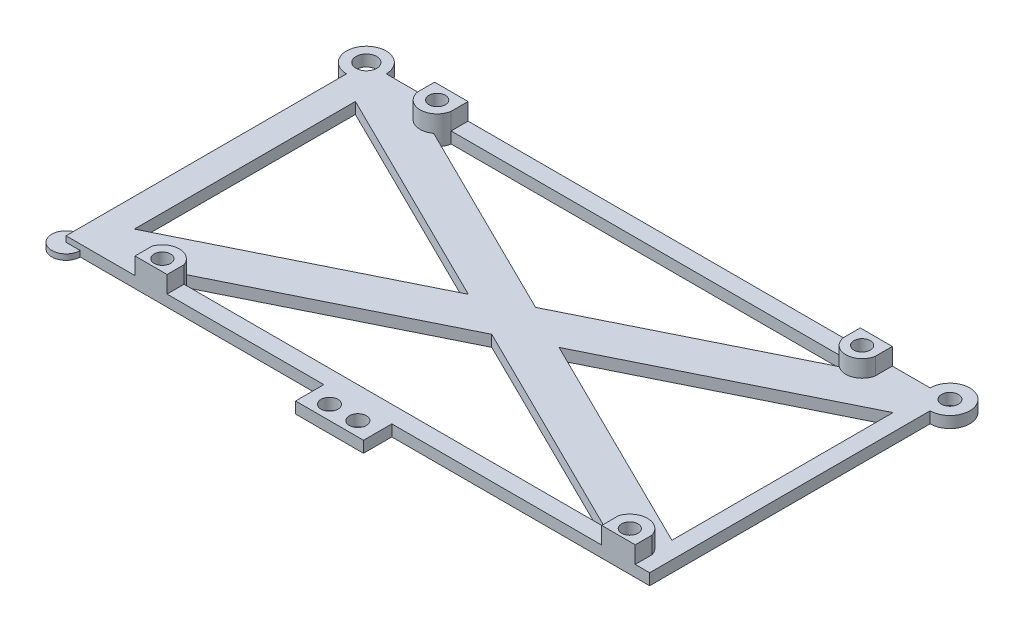
from build123d import *

# Parameters (mm, degrees)
SKETCH1_R             = 1.5
SKETCH1_R_2           = 1.823358757
BOSS_EXTRUDE1_DEPTH   = 2
SKETCH1_W             = 69.213532985
SKETCH1_H             = 3
BOSS_EXTRUDE1_2_DEPTH = 2
SKETCH2_R             = 1.45
SKETCH2_R_2           = 1.449999997
BOSS_EXTRUDE2_DEPTH   = 5
SKETCH3_R             = 2.5
BOSS_EXTRUDE3_DEPTH   = 1


with BuildPart() as part:
    # Sketch1 → Boss-Extrude1 (new body)
    with BuildSketch(Plane(origin=(0, 0, 0), x_dir=(1, 0, 0), z_dir=(0, 1, 0))):
        with BuildLine():
            Line((40.328427125, 26.5), (40.328427125, 23.5))
            ThreePointArc((40.328427125, 23.5), (38.533566599, 21.320123126), (35.739793711, 21.730270106))
            Line((35.739793711, 21.730270106), (-0.120981949, 3.988623195))
            Line((-0.120981949, 3.988623195), (-35.707345562, 21.594508352))
            ThreePointArc((-35.707345562, 21.594508352), (-38.6168059, 21.215624921), (-40.458039892, 23.5))
            Line((-40.458039892, 23.5), (-40.458039892, 26.5))
            Line((-40.458039892, 26.5), (-49, 26.5))
            ThreePointArc((-49, 26.5), (-54.974873735, 28.974873735), (-52.5, 23))
            Line((-52.5, 23), (-52.5, 0))
            Line((-52.5, 0), (-52.5, -26.5))
            Line((-52.5, -26.5), (-40.328427125, -26.5))
            Line((-40.328427125, -26.5), (-40.328427125, -23.5))
            ThreePointArc((-40.328427125, -23.5), (-38.560823049, -21.693818527), (-36.040421728, -21.879001857))
            Line((-36.040421728, -21.879001857), (0.120981949, -3.988623195))
            Line((0.120981949, -3.988623195), (39.558871233, -23.5))
            Line((39.558871233, -23.5), (-34.671572875, -23.5))
            Line((-34.671572875, -23.5), (-34.671572875, -26.5))
            Line((-34.671572875, -26.5), (-7, -26.5))
            Line((-7, -26.5), (-7, -31.5))
            Line((-7, -31.5), (5, -31.5))
            Line((5, -31.5), (5, -26.5))
            Line((5, -26.5), (42.041960109, -26.5))
            Line((42.041960109, -26.5), (42.041960109, -24.5))
            Line((42.041960109, -24.5), (42.041960108, -24.395234694))
            Line((42.041960109, -24.395234694), (42.041960109, -23.5))
            ThreePointArc((42.041960109, -23.5), (45, -21.377501001), (47.958039892, -23.5))
            Line((47.958039892, -23.5), (47.958039892, -26.5))
            Line((47.958039892, -26.5), (50.5, -26.5))
            Line((50.5, -26.5), (50.5, -25.302775638))
            Line((50.5, -25.302775638), (50.5, 22.341687605))
            Line((50.5, 22.341687605), (50.5, 23))
            ThreePointArc((50.5, 23), (52.974873734, 28.974873734), (47, 26.5))
            Line((47, 26.5), (40.328427125, 26.5))
        make_face()
        Polygon((8.062110713, -0.059854228), (47.5, 19.451522577), (47.5, -19.571231035), (42.041960107, -16.870937614), align=None, mode=Mode.SUBTRACT)
        with Locations(Location((-3.5, -29, 0), (0, 0, 270))):
            Circle(SKETCH1_R, mode=Mode.SUBTRACT)
        with Locations(Location((1.5, -29, 0), (0, 0, 270))):
            Circle(SKETCH1_R, mode=Mode.SUBTRACT)
        Polygon((-8.062110713, 0.059854228), (-47.5, -19.451522577), (-47.5, 19.571231035), align=None, mode=Mode.SUBTRACT)
        with Locations(Location((-52.5, 26.5, 0), (0, 0, 270))):
            Circle(SKETCH1_R_2, mode=Mode.SUBTRACT)
        with Locations(Location((50.5, 26.5, 0), (0, 0, 270))):
            Circle(SKETCH1_R, mode=Mode.SUBTRACT)
    extrude(amount=BOSS_EXTRUDE1_DEPTH)



with BuildPart() as body_2:
    # Sketch1 → Boss-Extrude1 2 (new body)
    with BuildSketch(Plane(origin=(0, 0, 0), x_dir=(1, 0, 0), z_dir=(0, 1, 0))):
        with Locations((0.064806384, 25)):
            Rectangle(SKETCH1_W, SKETCH1_H)
    extrude(amount=BOSS_EXTRUDE1_2_DEPTH)


with BuildPart() as part_1:
    add(part.part)

    add(body_2.part)  # Boss-Extrude2 merges body 2
    # Sketch2 → Boss-Extrude2 (add)
    # profile 1 of 4: a face of its own
    with BuildSketch(Plane(origin=(0, 0, 0), x_dir=(1, 0, 0), z_dir=(0, 1, 0))):
        with BuildLine():
            ThreePointArc((-34.671572875, -23.5), (-37.5, -21.5), (-40.328427125, -23.5))
            Line((-40.328427125, -23.5), (-40.328427125, -26.5))
            Line((-40.328427125, -26.5), (-34.671572875, -26.5))
            Line((-34.671572875, -26.5), (-34.671572875, -23.5))
        make_face()
        with Locations(Location((-37.5, -24.5, 0), (0, 0, 270))):
            Circle(SKETCH2_R, mode=Mode.SUBTRACT)
    # profile 2 of 4: a face of its own
    with BuildSketch(Plane(origin=(0, 0, 0), x_dir=(1, 0, 0), z_dir=(0, 1, 0))):
        with BuildLine():
            Line((-40.458039892, 26.5), (-40.458039892, 23.5))
            ThreePointArc((-40.458039892, 23.5), (-37.5, 21), (-34.541960108, 23.5))
            Line((-34.541960108, 23.5), (-34.541960108, 26.5))
            Line((-34.541960108, 26.5), (-40.458039892, 26.5))
        make_face()
        with Locations(Location((-37.5, 24, 0), (0, 0, 270))):
            Circle(SKETCH2_R, mode=Mode.SUBTRACT)
    # profile 3 of 4: a face of its own
    with BuildSketch(Plane(origin=(0, 0, 0), x_dir=(1, 0, 0), z_dir=(0, 1, 0))):
        with BuildLine():
            ThreePointArc((47.958039892, -23.5), (45, -21.377501001), (42.041960109, -23.5))
            Line((42.041960109, -23.5), (42.041960109, -26.5))
            Line((42.041960109, -26.5), (47.397915762, -26.5))
            Line((47.397915762, -26.5), (47.958039892, -26.5))
            Line((47.958039892, -26.5), (47.958039892, -23.5))
        make_face()
        with Locations(Location((45, -24.5, 0), (0, 0, 270))):
            Circle(SKETCH2_R, mode=Mode.SUBTRACT)
    # profile 4 of 4: a face of its own
    with BuildSketch(Plane(origin=(0, 0, 0), x_dir=(1, 0, 0), z_dir=(0, 1, 0))):
        with BuildLine():
            Line((40.328427125, 26.5), (34.671572877, 26.5))
            Line((34.671572877, 26.5), (34.671572877, 23.5))
            ThreePointArc((34.671572877, 23.5), (37.500000001, 21.127718682), (40.328427125, 23.5))
            Line((40.328427125, 23.5), (40.328427125, 24))
            Line((40.328427125, 24), (40.328427125, 26.5))
        make_face()
        with Locations(Location((37.500000001, 24.000000006, 0), (0, 0, 270))):
            Circle(SKETCH2_R_2, mode=Mode.SUBTRACT)
    extrude(amount=BOSS_EXTRUDE2_DEPTH)

    # Sketch3 → Boss-Extrude3 (add)
    with BuildSketch(Plane(origin=(0, 0, 0), x_dir=(1, 0, 0), z_dir=(0, 1, 0))):
        with Locations((-52.5, -26.5)):
            Circle(SKETCH3_R)
    extrude(amount=BOSS_EXTRUDE3_DEPTH)


solid = part_1.part
